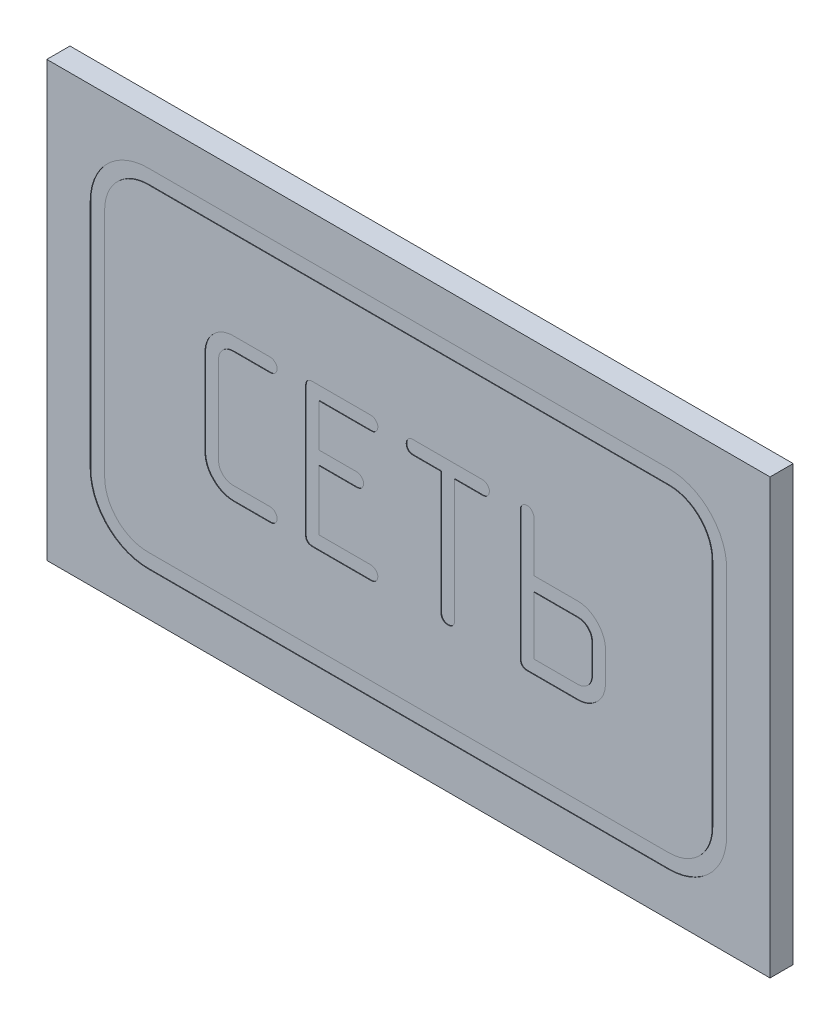
from build123d import *

# Parameters (mm, degrees)
SKETCH_1_W                 = 25
SKETCH_1_H                 = 15
EXTRUDE_1_DEPTH            = 0.8
CUT_EXTRUDE_1_DEPTH        = 0.02
CUT_EXTRUDE_1_2_DEPTH      = 0.02
CUT_EXTRUDE_1_2_DEPTH_BACK = 0.02


with BuildPart() as part:
    # Эскиз1 → Вытянуть1 (new body)
    with BuildSketch(Plane.XY):
        with Locations((12.5, 7.5)):
            Rectangle(SKETCH_1_W, SKETCH_1_H)
    extrude(amount=EXTRUDE_1_DEPTH)

    # Эскиз2 → Cut-Extrude 1 (cut)
    # profile 1 of 4: a face of its own
    with BuildSketch(Plane.XY.offset(0.8)):
        with BuildLine():
            Line((7.712720891, 5), (6.466081437, 5))
            add(Edge.make_bspline(
                [(6.466081437, 5), (6.432594004, 5.000692727), (6.36672374, 5.002055332), (6.269739824, 5.016155058), (6.176663795, 5.039045252), (6.087004544, 5.071133737), (5.999690452, 5.110058603), (5.917241298, 5.161340691), (5.837616903, 5.219686837), (5.762545288, 5.286333648), (5.694350149, 5.360101058), (5.633367513, 5.437919276), (5.582928648, 5.520642766), (5.540689082, 5.606472629), (5.50806155, 5.696904789), (5.485720454, 5.791261217), (5.469833581, 5.889077847), (5.468712392, 5.955725789), (5.468142896, 5.989578846)],
                knots=[0, 0, 0, 0, 1.028286897, 2.022655204, 3.003804875, 3.968473356, 4.945411562, 5.93469887, 6.945007337, 7.975963957, 9.013399247, 10.028062878, 11.008219808, 11.984630304, 12.962974347, 13.954516674, 14.96102025, 16, 16, 16, 16], degree=3))
            Line((5.468142896, 5.989578846), (5.468142896, 8.959360345))
            add(Edge.make_bspline(
                [(5.468142896, 8.959360345), (5.468832017, 8.993196462), (5.470187697, 9.059760988), (5.484342684, 9.157771545), (5.50704762, 9.252048958), (5.539802191, 9.342223619), (5.580798425, 9.428250387), (5.629895298, 9.510871714), (5.690452599, 9.587896142), (5.757615308, 9.66152169), (5.831134128, 9.729490115), (5.910663187, 9.787839016), (5.99381678, 9.837060021), (6.080120721, 9.878872138), (6.171262597, 9.909500728), (6.265865627, 9.932989366), (6.364656273, 9.94684024), (6.431902866, 9.94823188), (6.466081437, 9.948939191)],
                knots=[0, 0, 0, 0, 1.037183757, 2.040412751, 3.030241086, 4.006893952, 4.976980221, 5.949886173, 6.947810811, 7.976208698, 9.004606584, 10.01316862, 10.99524074, 11.965327009, 12.948502614, 13.93833095, 14.952141686, 16, 16, 16, 16], degree=3))
            Line((6.466081437, 9.948939191), (7.712720891, 9.948939191))
            add(Edge.make_bspline(
                [(7.712720891, 9.948939191), (7.729534575, 9.948260577), (7.762363923, 9.946935558), (7.809526879, 9.932825932), (7.851990056, 9.908919078), (7.890355018, 9.877963507), (7.921810596, 9.841212777), (7.946075963, 9.801645036), (7.96028189, 9.75901051), (7.961737722, 9.729597193), (7.962466766, 9.714867742)],
                knots=[0, 0, 0, 0, 1.064052253, 2.077601868, 3.0860831, 4.13837496, 5.187880517, 6.138828305, 7.06797199, 8, 8, 8, 8], degree=3))
            add(Edge.make_bspline(
                [(7.962466766, 9.714867742), (7.959118027, 9.687806092), (7.951965921, 9.630008892), (7.90987753, 9.566240769), (7.864472187, 9.521900314), (7.819964597, 9.496970695), (7.767086251, 9.483913753), (7.729509952, 9.4818765), (7.709586005, 9.480796294)],
                knots=[0, 0, 0, 0, 1.266254501, 2.704416213, 3.467614585, 4.236046379, 5.064705186, 6, 6, 6, 6], degree=3))
            Line((7.709586005, 9.480796294), (6.443092277, 9.480796294))
            add(Edge.make_bspline(
                [(6.443092277, 9.480796294), (6.408794748, 9.478882843), (6.34160794, 9.475134506), (6.244915166, 9.448770848), (6.156645308, 9.402789911), (6.106876064, 9.359617997), (6.081535486, 9.337636525)],
                knots=[0, 0, 0, 0, 1.032059628, 2.021743112, 2.992747939, 4, 4, 4, 4], degree=3))
            add(Edge.make_bspline(
                [(6.081535486, 9.337636525), (6.059153804, 9.312697787), (6.014847759, 9.263329879), (5.968634885, 9.174990536), (5.942016595, 9.078979494), (5.938216169, 9.01281964), (5.936285793, 8.97921462)],
                knots=[0, 0, 0, 0, 1.010358544, 2.000072701, 2.984163436, 4, 4, 4, 4], degree=3))
            Line((5.936285793, 8.97921462), (5.936285793, 5.969724571))
            add(Edge.make_bspline(
                [(5.936285793, 5.969724571), (5.938065535, 5.935730163), (5.941556759, 5.86904517), (5.969963399, 5.773602667), (6.01490949, 5.685142468), (6.059068299, 5.636202446), (6.081535486, 5.611302666)],
                knots=[0, 0, 0, 0, 1.026550069, 2.013727771, 2.989421339, 4, 4, 4, 4], degree=3))
            add(Edge.make_bspline(
                [(6.081535486, 5.611302666), (6.107073235, 5.590564837), (6.157628302, 5.549511793), (6.215076276, 5.518846436), (6.243504569, 5.503671598)],
                knots=[0, 0, 0, 0, 1.010294363, 2, 2, 2, 2], degree=3))
            add(Edge.make_bspline(
                [(6.243504569, 5.503671598), (6.278098786, 5.493592643), (6.343382807, 5.474572275), (6.411207916, 5.470198836), (6.443092277, 5.468142896)],
                knots=[0, 0, 0, 0, 1.059806561, 2, 2, 2, 2], degree=3))
            Line((6.443092277, 5.468142896), (7.709586005, 5.468142896))
            add(Edge.make_bspline(
                [(7.709586005, 5.468142896), (7.72639695, 5.467438317), (7.759555962, 5.466048558), (7.80736266, 5.452002878), (7.850788386, 5.428447892), (7.889260182, 5.397122186), (7.920876087, 5.360460687), (7.944737485, 5.32063225), (7.960585602, 5.278431684), (7.961840648, 5.248836124), (7.962466766, 5.234071448)],
                knots=[0, 0, 0, 0, 1.057748023, 2.086371758, 3.108174774, 4.154232081, 5.197519594, 6.142833266, 7.073494011, 8, 8, 8, 8], degree=3))
            add(Edge.make_bspline(
                [(7.962466766, 5.234071448), (7.959075364, 5.207024184), (7.951854849, 5.149438802), (7.91074112, 5.085800741), (7.86649285, 5.040804159), (7.82200973, 5.016224279), (7.769528985, 5.003192055), (7.732298521, 5.00110007), (7.712720891, 5)],
                knots=[0, 0, 0, 0, 1.274021799, 2.712475087, 3.468462899, 4.24160831, 5.075350171, 6, 6, 6, 6], degree=3))
        make_face()
    # profile 2 of 4: a face of its own
    with BuildSketch(Plane.XY.offset(0.8)):
        with BuildLine():
            Line((9.413918738, 8.009490048), (10.695041932, 8.009490048))
            add(Edge.make_bspline(
                [(10.695041932, 8.009490048), (10.71220603, 8.008815433), (10.745723261, 8.007498076), (10.793848112, 7.993336269), (10.83734843, 7.969847044), (10.875711754, 7.938123402), (10.908488041, 7.902167479), (10.932237344, 7.861938888), (10.948142816, 7.819788846), (10.94939028, 7.790186607), (10.950012616, 7.7754186)],
                knots=[0, 0, 0, 0, 1.074751076, 2.09872259, 3.115904232, 4.15723047, 5.210194549, 6.151232792, 7.077684378, 8, 8, 8, 8], degree=3))
            add(Edge.make_bspline(
                [(10.950012616, 7.7754186), (10.949077623, 7.761773306), (10.947176226, 7.734024329), (10.935630837, 7.69294633), (10.914535813, 7.653487369), (10.887505958, 7.615447239), (10.851388338, 7.582204524), (10.806449832, 7.557510219), (10.752857605, 7.544563215), (10.714958521, 7.542455035), (10.695041932, 7.541347152)],
                knots=[0, 0, 0, 0, 0.847894216, 1.724271911, 2.623827054, 3.614447941, 4.609544371, 5.645179484, 6.762503223, 8, 8, 8, 8], degree=3))
            Line((10.695041932, 7.541347152), (9.413918738, 7.541347152))
            Line((9.413918738, 7.541347152), (9.413918738, 5.468142896))
            Line((9.413918738, 5.468142896), (11.190353836, 5.468142896))
            add(Edge.make_bspline(
                [(11.190353836, 5.468142896), (11.20716478, 5.467438317), (11.240323793, 5.466048558), (11.28813049, 5.452002878), (11.331556216, 5.428447892), (11.370028013, 5.397122186), (11.401643917, 5.360460687), (11.425505315, 5.32063225), (11.441353433, 5.278431684), (11.442608478, 5.248836124), (11.443234597, 5.234071448)],
                knots=[0, 0, 0, 0, 1.057748023, 2.086371758, 3.108174774, 4.154232081, 5.197519594, 6.142833266, 7.073494011, 8, 8, 8, 8], degree=3))
            add(Edge.make_bspline(
                [(11.443234597, 5.234071448), (11.439970293, 5.206303519), (11.433146645, 5.148257896), (11.391753483, 5.08437607), (11.346895575, 5.040850435), (11.302822006, 5.016175996), (11.250283892, 5.003206093), (11.213061898, 5.001104908), (11.193488721, 5)],
                knots=[0, 0, 0, 0, 1.304816916, 2.72756791, 3.471350905, 4.243614303, 5.076405022, 6, 6, 6, 6], degree=3))
            Line((11.193488721, 5), (9.195521717, 5))
            add(Edge.make_bspline(
                [(9.195521717, 5), (9.175929594, 5.000307582), (9.138792861, 5.000890603), (9.087466563, 5.012983654), (9.042781393, 5.029906113), (9.007659914, 5.057248955), (8.979452875, 5.090506234), (8.959095788, 5.131591129), (8.948223982, 5.180226174), (8.94661803, 5.214862558), (8.945775841, 5.233026486)],
                knots=[0, 0, 0, 0, 1.198038817, 2.270874244, 3.219060548, 4.103495656, 4.967836238, 5.87544602, 6.885846531, 8, 8, 8, 8], degree=3))
            Line((8.945775841, 5.233026486), (8.945775841, 9.701283239))
            add(Edge.make_bspline(
                [(8.945775841, 9.701283239), (8.946584458, 9.72083547), (8.948102335, 9.757537502), (8.959035393, 9.808966839), (8.97978577, 9.852066813), (9.006849846, 9.888423562), (9.042765347, 9.916762559), (9.087192975, 9.935254615), (9.138870349, 9.946664692), (9.17594963, 9.94815339), (9.195521717, 9.948939191)],
                knots=[0, 0, 0, 0, 1.164715309, 2.18631923, 3.105001799, 3.992953645, 4.864517145, 5.793449026, 6.835284691, 8, 8, 8, 8], degree=3))
            Line((9.195521717, 9.948939191), (11.193488721, 9.948939191))
            add(Edge.make_bspline(
                [(11.193488721, 9.948939191), (11.210302405, 9.948260577), (11.243131753, 9.946935558), (11.290294709, 9.932825932), (11.332757886, 9.908919078), (11.371122849, 9.877963507), (11.402578426, 9.841212777), (11.426843793, 9.801645036), (11.44104972, 9.75901051), (11.442505553, 9.729597193), (11.443234597, 9.714867742)],
                knots=[0, 0, 0, 0, 1.064052253, 2.077601868, 3.0860831, 4.13837496, 5.187880517, 6.138828305, 7.06797199, 8, 8, 8, 8], degree=3))
            add(Edge.make_bspline(
                [(11.443234597, 9.714867742), (11.442299516, 9.701222598), (11.440397943, 9.673473926), (11.428853923, 9.632393563), (11.407753346, 9.592944192), (11.380746441, 9.554864427), (11.344766631, 9.521982358), (11.300809383, 9.496912558), (11.247831246, 9.483931004), (11.21026987, 9.481882477), (11.190353836, 9.480796294)],
                knots=[0, 0, 0, 0, 0.852137248, 1.732900512, 2.636957208, 3.632535361, 4.632611452, 5.654418168, 6.756310542, 8, 8, 8, 8], degree=3))
            Line((11.190353836, 9.480796294), (9.413918738, 9.480796294))
            Line((9.413918738, 9.480796294), (9.413918738, 8.009490048))
        make_face()
    # profile 3 of 4: a face of its own
    with BuildSketch(Plane.XY.offset(0.8)):
        with BuildLine():
            Line((13.627204805, 9.480796294), (12.663750005, 9.480796294))
            add(Edge.make_bspline(
                [(12.663750005, 9.480796294), (12.646256284, 9.481600555), (12.612606269, 9.483147588), (12.564462577, 9.495019549), (12.520670743, 9.514239942), (12.496843806, 9.534513711), (12.485061534, 9.544538965)],
                knots=[0, 0, 0, 0, 1.079416544, 2.076309691, 3.048747018, 4, 4, 4, 4], degree=3))
            add(Edge.make_bspline(
                [(12.485061534, 9.544538965), (12.475507066, 9.557470331), (12.457039335, 9.582465235), (12.437869097, 9.624736881), (12.425978749, 9.668931994), (12.424270413, 9.699466955), (12.423408786, 9.714867742)],
                knots=[0, 0, 0, 0, 1.042916738, 2.015842924, 2.999259183, 4, 4, 4, 4], degree=3))
            add(Edge.make_bspline(
                [(12.423408786, 9.714867742), (12.42647903, 9.741844882), (12.432949571, 9.798699217), (12.472106892, 9.86297596), (12.516304158, 9.906228362), (12.558084992, 9.933054857), (12.608740458, 9.945556651), (12.644198811, 9.947779206), (12.662705043, 9.948939191)],
                knots=[0, 0, 0, 0, 1.300166254, 2.740100978, 3.513473502, 4.283912407, 5.104348798, 6, 6, 6, 6], degree=3))
            Line((12.662705043, 9.948939191), (15.059847464, 9.948939191))
            add(Edge.make_bspline(
                [(15.059847464, 9.948939191), (15.075977897, 9.948278295), (15.107467523, 9.946988104), (15.152756996, 9.932523989), (15.19380813, 9.909177673), (15.230275209, 9.877854716), (15.259647789, 9.840903399), (15.282625406, 9.801384709), (15.297004685, 9.759033499), (15.298429973, 9.729604863), (15.299143721, 9.714867742)],
                knots=[0, 0, 0, 0, 1.043365491, 2.036844728, 3.048657267, 4.090308507, 5.13489674, 6.096248124, 7.046648906, 8, 8, 8, 8], degree=3))
            add(Edge.make_bspline(
                [(15.299143721, 9.714867742), (15.296131454, 9.687831098), (15.289729782, 9.630372821), (15.249344761, 9.56683417), (15.206532313, 9.52197673), (15.164061812, 9.496976876), (15.11353838, 9.483988573), (15.077682122, 9.481897382), (15.058802502, 9.480796294)],
                knots=[0, 0, 0, 0, 1.296042091, 2.754348639, 3.513317893, 4.272657647, 5.090491591, 6, 6, 6, 6], degree=3))
            Line((15.058802502, 9.480796294), (14.095347702, 9.480796294))
            Line((14.095347702, 9.480796294), (14.095347702, 5.248700914))
            add(Edge.make_bspline(
                [(14.095347702, 5.248700914), (14.094610391, 5.230158786), (14.093186729, 5.194356051), (14.080455037, 5.143643645), (14.05950943, 5.098141545), (14.038807782, 5.073108408), (14.028470145, 5.060607786)],
                knots=[0, 0, 0, 0, 1.08722023, 2.099298278, 3.050859919, 4, 4, 4, 4], degree=3))
            add(Edge.make_bspline(
                [(14.028470145, 5.060607786), (14.017307832, 5.051405789), (13.995051798, 5.033058342), (13.954735374, 5.013904777), (13.909628511, 5.00246823), (13.877717268, 5.000839262), (13.861276254, 5)],
                knots=[0, 0, 0, 0, 0.951182289, 1.896519658, 2.916264364, 4, 4, 4, 4], degree=3))
            add(Edge.make_bspline(
                [(13.861276254, 5), (13.845862844, 5.000797061), (13.815976745, 5.002342537), (13.77288964, 5.014671885), (13.732590207, 5.033466692), (13.695748711, 5.060606042), (13.665017099, 5.096525953), (13.642978253, 5.140620154), (13.628855215, 5.192115184), (13.627776719, 5.229092348), (13.627204805, 5.248700914)],
                knots=[0, 0, 0, 0, 0.960624492, 1.862619603, 2.776848362, 3.724840655, 4.696474829, 5.698056661, 6.779305879, 8, 8, 8, 8], degree=3))
            Line((13.627204805, 5.248700914), (13.627204805, 9.480796294))
        make_face()
    # profile 4 of 4: a face of its own
    with BuildSketch(Plane.XY.offset(0.8)):
        with BuildLine():
            Line((16.837327524, 7.962466766), (16.837327524, 9.700238277))
            add(Edge.make_bspline(
                [(16.837327524, 9.700238277), (16.836633146, 9.716361314), (16.835263209, 9.748170408), (16.820955899, 9.794162084), (16.797383661, 9.836444683), (16.765989982, 9.874656944), (16.729998039, 9.907410192), (16.689778089, 9.931165022), (16.647625895, 9.947069117), (16.618023941, 9.948316763), (16.603256075, 9.948939191)],
                knots=[0, 0, 0, 0, 1.02561598, 2.023434959, 3.037439818, 4.095495264, 5.165375516, 6.12153181, 7.062867111, 8, 8, 8, 8], degree=3))
            add(Edge.make_bspline(
                [(16.603256075, 9.948939191), (16.576253271, 9.945473953), (16.518940416, 9.938119061), (16.45477736, 9.898279524), (16.409991141, 9.853984527), (16.385630668, 9.809819345), (16.372236103, 9.757783649), (16.370242513, 9.720870804), (16.369184627, 9.701283239)],
                knots=[0, 0, 0, 0, 1.279197715, 2.715068902, 3.474128036, 4.250414473, 5.071593634, 6, 6, 6, 6], degree=3))
            Line((16.369184627, 9.701283239), (16.369184627, 5.247655952))
            add(Edge.make_bspline(
                [(16.369184627, 5.247655952), (16.369957035, 5.228087079), (16.371406942, 5.191353809), (16.382755152, 5.140273599), (16.401932713, 5.096618277), (16.429281691, 5.060526693), (16.464897987, 5.032463189), (16.508448322, 5.013623451), (16.55914137, 5.002284393), (16.59552859, 5.00078963), (16.614750655, 5)],
                knots=[0, 0, 0, 0, 1.174787525, 2.205226063, 3.123069814, 4.018700482, 4.897801082, 5.815644833, 6.846083372, 8, 8, 8, 8], degree=3))
            Line((16.614750655, 5), (18.330577968, 5))
            add(Edge.make_bspline(
                [(18.330577968, 5), (18.363025955, 5.000681067), (18.427171805, 5.002027455), (18.521571154, 5.016439935), (18.613094971, 5.037994534), (18.701392241, 5.069592231), (18.786151301, 5.110788213), (18.867882487, 5.159785205), (18.945980313, 5.218231083), (19.020111164, 5.28425401), (19.089195557, 5.356640655), (19.148413714, 5.435224221), (19.199403362, 5.517170439), (19.240046474, 5.603639761), (19.272917274, 5.693739269), (19.295590624, 5.788037051), (19.309803738, 5.88638775), (19.31112309, 5.953303197), (19.311797119, 5.987488922)],
                knots=[0, 0, 0, 0, 1.005611403, 1.987975318, 2.954832135, 3.918424373, 4.889616893, 5.873405385, 6.869454867, 7.910141302, 8.94948115, 9.967147977, 10.956555291, 11.937492561, 12.925069879, 13.925970042, 14.940420758, 16, 16, 16, 16], degree=3))
            Line((19.311797119, 5.987488922), (19.311797119, 6.974977844))
            add(Edge.make_bspline(
                [(19.311797119, 6.974977844), (19.311098198, 7.008114716), (19.309723586, 7.073287096), (19.295716127, 7.169271502), (19.272395353, 7.261478076), (19.241493315, 7.350779508), (19.199909716, 7.43575861), (19.150741631, 7.517936733), (19.09172552, 7.596531445), (19.024424737, 7.670868352), (18.9511124, 7.739191903), (18.873377483, 7.799452778), (18.791445811, 7.850014335), (18.705034829, 7.890731892), (18.614919618, 7.923582639), (18.520626011, 7.946261378), (18.422619821, 7.960423429), (18.356054695, 7.961778139), (18.322218273, 7.962466766)],
                knots=[0, 0, 0, 0, 1.022954788, 2.011909854, 2.987787447, 3.957537673, 4.924718387, 5.904443042, 6.911432781, 7.954998824, 8.997899186, 10.002817874, 10.988138141, 11.965023352, 12.948521182, 13.945286823, 14.955547042, 16, 16, 16, 16], degree=3))
            Line((18.322218273, 7.962466766), (16.837327524, 7.962466766))
        make_face()
        with BuildLine():
            Line((16.837327524, 7.469244786), (18.342072548, 7.469244786))
            add(Edge.make_bspline(
                [(18.342072548, 7.469244786), (18.376084474, 7.467957354), (18.442497586, 7.46544346), (18.537287491, 7.436250462), (18.624619334, 7.392593814), (18.700459668, 7.330020197), (18.764710292, 7.25583133), (18.810524426, 7.168598286), (18.838486254, 7.071771078), (18.841897966, 7.00373249), (18.843654223, 6.968708073)],
                knots=[0, 0, 0, 0, 1.028363177, 2.008025063, 2.981456648, 3.973180373, 4.970236738, 5.939185353, 6.939148595, 8, 8, 8, 8], degree=3))
            Line((18.843654223, 6.968708073), (18.843654223, 5.968679609))
            add(Edge.make_bspline(
                [(18.843654223, 5.968679609), (18.841796984, 5.934710101), (18.838177299, 5.868504858), (18.811132986, 5.773105294), (18.765957215, 5.685484435), (18.722521735, 5.63626377), (18.700494453, 5.611302666)],
                knots=[0, 0, 0, 0, 1.031628677, 2.010603999, 2.991124575, 4, 4, 4, 4], degree=3))
            add(Edge.make_bspline(
                [(18.700494453, 5.611302666), (18.675553674, 5.589238122), (18.626140933, 5.545523785), (18.537576855, 5.500688724), (18.441867131, 5.473811382), (18.375687576, 5.470052282), (18.342072548, 5.468142896)],
                knots=[0, 0, 0, 0, 1.00659897, 1.994276692, 2.98121943, 4, 4, 4, 4], degree=3))
            Line((18.342072548, 5.468142896), (16.837327524, 5.468142896))
            Line((16.837327524, 5.468142896), (16.837327524, 7.469244786))
        make_face(mode=Mode.SUBTRACT)
    extrude(amount=-CUT_EXTRUDE_1_DEPTH, mode=Mode.SUBTRACT)

    # Эскиз3 → Cut-Extrude 1 2 (cut, two sides: drawn at the far end of the back side and taken through both)
    with BuildSketch(Plane.XY.offset(0.8).offset(-CUT_EXTRUDE_1_2_DEPTH_BACK)):
        with BuildLine():
            Line((3.5, 1.5), (21.5, 1.5))
            ThreePointArc((21.5, 1.5), (22.914213562, 2.085786438), (23.5, 3.5))
            Line((23.5, 3.5), (23.5, 11.5))
            ThreePointArc((23.5, 11.5), (22.914213562, 12.914213562), (21.5, 13.5))
            Line((21.5, 13.5), (3.5, 13.5))
            ThreePointArc((3.5, 13.5), (2.085786438, 12.914213562), (1.5, 11.5))
            Line((1.5, 11.5), (1.5, 3.5))
            ThreePointArc((1.5, 3.5), (2.085786438, 2.085786438), (3.5, 1.5))
        make_face()
        with BuildLine():
            Line((3.5, 2), (21.5, 2))
            ThreePointArc((21.5, 2), (22.560660172, 2.439339828), (23, 3.5))
            Line((23, 3.5), (23, 11.5))
            ThreePointArc((23, 11.5), (22.560660172, 12.560660172), (21.5, 13))
            Line((21.5, 13), (3.5, 13))
            ThreePointArc((3.5, 13), (2.439339828, 12.560660172), (2, 11.5))
            Line((2, 11.5), (2, 3.5))
            ThreePointArc((2, 3.5), (2.439339828, 2.439339828), (3.5, 2))
        make_face(mode=Mode.SUBTRACT)
    extrude(amount=CUT_EXTRUDE_1_2_DEPTH + CUT_EXTRUDE_1_2_DEPTH_BACK, mode=Mode.SUBTRACT)


solid = part.part
